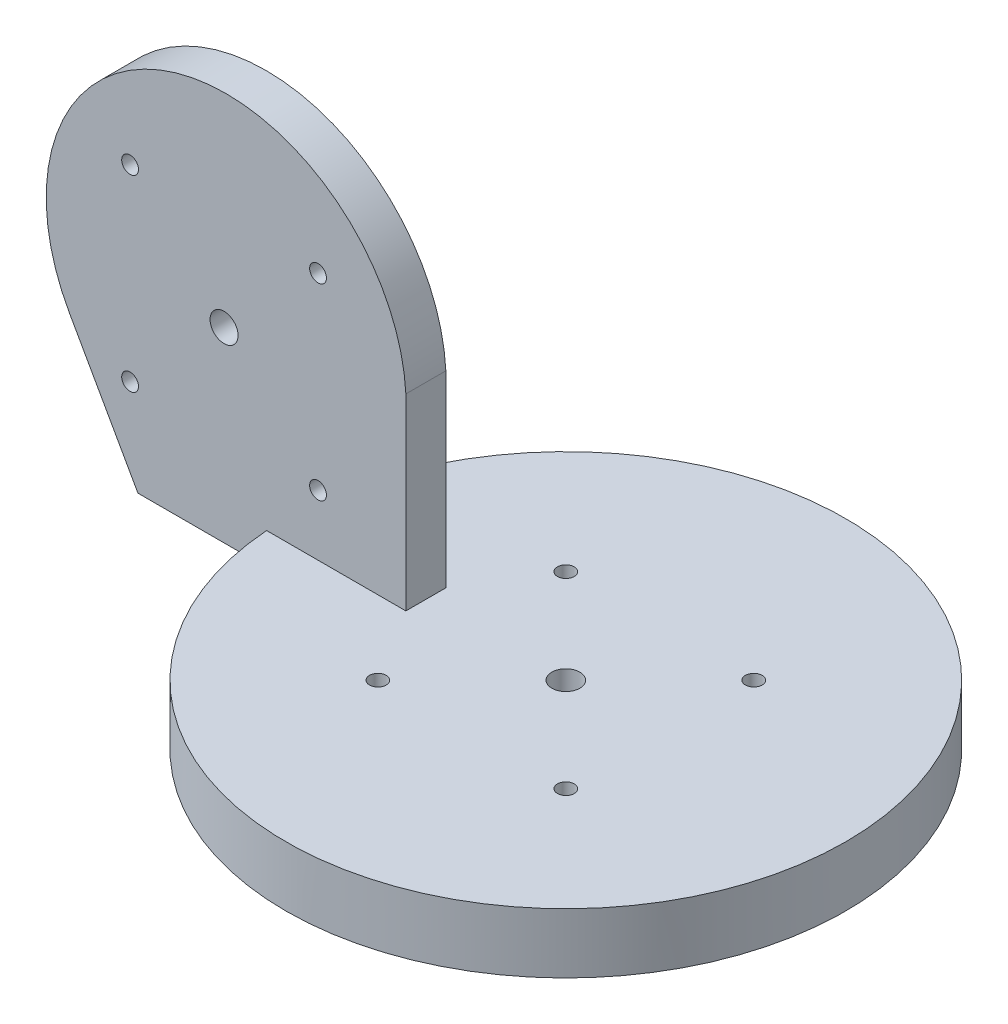
from build123d import *

# Parameters (mm, degrees)
SKETCH1_R                 = 70
BOSS_EXTRUDE2_DEPTH       = 15
SKETCH2_R                 = 65
BOSS_EXTRUDE3_DEPTH       = 3
BOSS_EXTRUDE4_DEPTH       = 5
M5X0_8_TAPPED_HOLE2_D     = 4.2
M5X0_8_TAPPED_HOLE2_DEPTH = 10
M5X0_8_TAPPED_HOLE2_TIP   = 1.2618073
SKETCH8_R                 = 3.5
CUT_EXTRUDE1_DEPTH        = 169.909563464
M5X0_8_TAPPED_HOLE3_D     = 4.2
M5X0_8_TAPPED_HOLE3_DEPTH = 10
M5X0_8_TAPPED_HOLE3_TIP   = 1.2618073
SKETCH14_R                = 3.5
CUT_EXTRUDE2_DEPTH        = 178.408330527


with BuildPart() as part:
    # Sketch1 → Boss-Extrude2 (new body)
    with BuildSketch(Plane(origin=(0, 0, 0), x_dir=(1, 0, 0), z_dir=(0, 1, 0))):
        with Locations(Location((0, 0, 0), (0, 0, 270))):
            Circle(SKETCH1_R)
    extrude(amount=BOSS_EXTRUDE2_DEPTH)

    # Sketch2 → Boss-Extrude3 (add)
    with BuildSketch(Plane.XZ):
        with Locations(Location((0, 0, 0), (0, 0, 270))):
            Circle(SKETCH2_R)
    extrude(amount=BOSS_EXTRUDE3_DEPTH)

    # Sketch3 → Boss-Extrude4 (add, symmetric)
    with BuildSketch(Plane.XY):
        with BuildLine():
            Line((-35, 62), (-35, 7))
            Line((-35, 7), (-102, 7))
            Line((-102, 7), (-119.156726544, 37.506503148))
            ThreePointArc((-119.156726544, 37.506503148), (-92.509371405, 102.772350464), (-35, 62))
        make_face()
    extrude(amount=BOSS_EXTRUDE4_DEPTH, both=True)

    # M5x0.8 Tapped Hole2
    with Locations(Plane(origin=(0, 15, 0), x_dir=(1, 0, 0), z_dir=(0, 1, 0))):
        with Locations((-23.5, 23.5), (23.5, 23.5), (23.5, -23.5), (-23.5, -23.5)):
            Hole(M5X0_8_TAPPED_HOLE2_D / 2, depth=M5X0_8_TAPPED_HOLE2_DEPTH)
            with Locations((0, 0, -(M5X0_8_TAPPED_HOLE2_DEPTH + M5X0_8_TAPPED_HOLE2_TIP / 2))):  # 118° drill point
                Cone(0, M5X0_8_TAPPED_HOLE2_D / 2, M5X0_8_TAPPED_HOLE2_TIP, mode=Mode.SUBTRACT)

    # Sketch8 → Cut-Extrude1 (cut, through all)
    with BuildSketch(Plane(origin=(0, 15, 0), x_dir=(1, 0, 0), z_dir=(0, 1, 0))):
        with Locations(Location((0, 0, 0), (0, 0, 270))):
            Circle(SKETCH8_R)
    extrude(amount=-CUT_EXTRUDE1_DEPTH, mode=Mode.SUBTRACT)

    # M5x0.8 Tapped Hole3
    with Locations(Plane(origin=(-80.46035162, 53.660377077, 5), x_dir=(1, 0, 0), z_dir=(0, 0, 1))):
        with Locations((-23.5, 23.5), (23.5, 23.5), (23.5, -23.5), (-23.5, -23.5)):
            Hole(M5X0_8_TAPPED_HOLE3_D / 2, depth=M5X0_8_TAPPED_HOLE3_DEPTH)
            with Locations((0, 0, -(M5X0_8_TAPPED_HOLE3_DEPTH + M5X0_8_TAPPED_HOLE3_TIP / 2))):  # 118° drill point
                Cone(0, M5X0_8_TAPPED_HOLE3_D / 2, M5X0_8_TAPPED_HOLE3_TIP, mode=Mode.SUBTRACT)

    # Sketch14 → Cut-Extrude2 (cut, through all)
    with BuildSketch(Plane(origin=(-80.46035162, 53.660377077, 5), x_dir=(1, 0, 0), z_dir=(0, 0, 1))):
        Circle(SKETCH14_R)
    extrude(amount=-CUT_EXTRUDE2_DEPTH, mode=Mode.SUBTRACT)


solid = part.part
